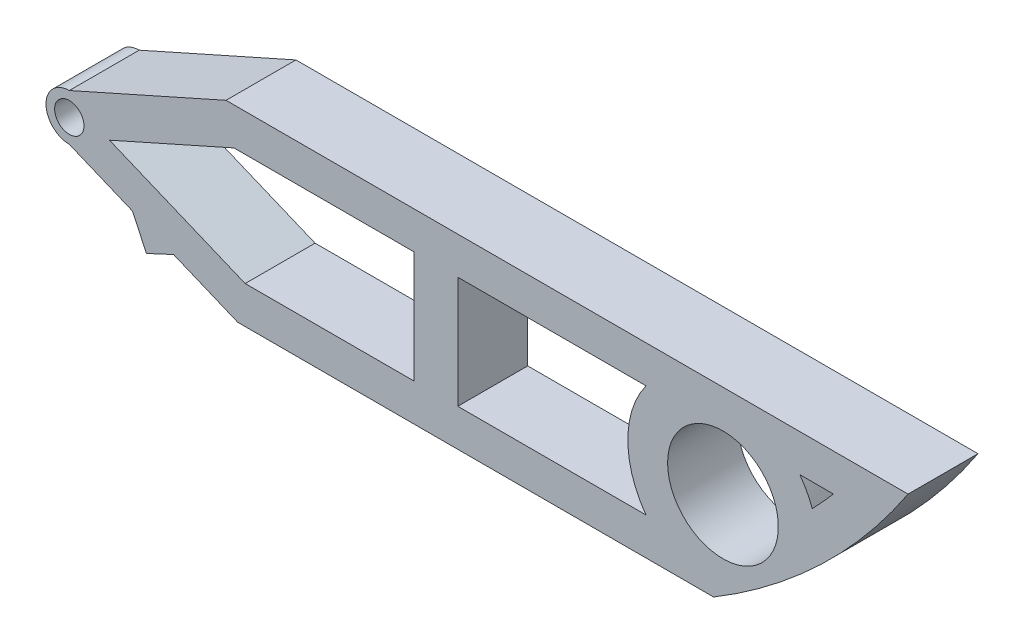
from build123d import *

# Parameters (mm, degrees)
SKETCH1_W           = 241.3
SKETCH1_H           = 50.8
BOSS_EXTRUDE1_DEPTH = 19.06
SKETCH3_R           = 4
CUT_EXTRUDE1_DEPTH  = 125.759232524
CUT_EXTRUDE2_DEPTH  = 125.759232524
SKETCH11_R          = 15.09
CUT_EXTRUDE3_DEPTH  = 125.759232524
BOSS_EXTRUDE2_DEPTH = 19.06
CUT_EXTRUDE4_DEPTH  = 125.759232524


with BuildPart() as part:
    # Sketch1 → Boss-Extrude1 (new body)
    with BuildSketch(Plane.XY):
        Rectangle(SKETCH1_W, SKETCH1_H)
    extrude(amount=BOSS_EXTRUDE1_DEPTH)

    # Sketch3 → Cut-Extrude1 (cut, through all)
    with BuildSketch(Plane.XY.offset(19.06)):
        with Locations((-107.95, 0)):
            Circle(SKETCH3_R)
    extrude(amount=-CUT_EXTRUDE1_DEPTH, mode=Mode.SUBTRACT)

    # Sketch5 → Cut-Extrude2 (cut, through all)
    with BuildSketch(Plane.XY.offset(19.06)):
        with BuildLine():
            ThreePointArc((67.637087091, -25.4), (97.003321964, -2.984354021), (120.65, 25.4))
            Line((120.65, 25.4), (120.65, -25.4))
            Line((120.65, -25.4), (67.637087091, -25.4))
        make_face()
        with BuildLine():
            Line((-62.046109456, -25.4), (-107.95, -6.35))
            ThreePointArc((-107.95, -6.35), (-114.3, 0), (-107.95, 6.35))
            Line((-107.95, 6.35), (-65.239311186, 25.4))
            Line((-65.239311186, 25.4), (-120.65, 25.4))
            Line((-120.65, 25.4), (-120.65, -25.4))
            Line((-120.65, -25.4), (-62.046109456, -25.4))
        make_face()
    extrude(amount=-CUT_EXTRUDE2_DEPTH, mode=Mode.SUBTRACT)

    # Sketch11 → Cut-Extrude3 (cut, through all)
    with BuildSketch(Plane(origin=(0, 0, 0), x_dir=(-1, 0, 0), z_dir=(0, 0, -1))):
        with Locations((-70.2, 0)):
            Circle(SKETCH11_R)
    extrude(amount=-CUT_EXTRUDE3_DEPTH, mode=Mode.SUBTRACT)

    # Sketch12 → Boss-Extrude2 (add)
    with BuildSketch(Plane(origin=(0, 0, 0), x_dir=(-1, 0, 0), z_dir=(0, 0, -1))):
        Polygon((86.939525855, -21.602548055), (79.526368634, -18.145736072), (90.717044303, -13.501633601), align=None)
    extrude(amount=-BOSS_EXTRUDE2_DEPTH)

    # Sketch13 → Cut-Extrude4 (cut, through all)
    with BuildSketch(Plane(origin=(0, 0, 0), x_dir=(-1, 0, 0), z_dir=(0, 0, -1))):
        with BuildLine():
            Line((-91.17795532, 15.24), (-100.287694386, 15.24))
            ThreePointArc((-100.287694386, 15.24), (-97.460762969, 12.040493243), (-94.546748719, 8.920091718))
            ThreePointArc((-94.546748719, 8.920091718), (-93.081597611, 12.196913552), (-91.17795532, 15.24))
        make_face()
        Polygon((13.984519796, -15.24), (60.021626843, -15.24), (79.764838161, -7.046616582), (83.177072141, -5.630547997), (97.003760461, 0.107493144), (63.076212362, 15.24), (13.984519796, 15.24), align=None)
        with BuildLine():
            Line((2.07417074, -15.24), (2.07417074, 15.24))
            Line((2.07417074, 15.24), (-49.22204468, 15.24))
            ThreePointArc((-49.22204468, 15.24), (-44.27063037, 0), (-49.22204468, -15.24))
            Line((-49.22204468, -15.24), (2.07417074, -15.24))
        make_face()
    extrude(amount=-CUT_EXTRUDE4_DEPTH, mode=Mode.SUBTRACT)


solid = part.part
